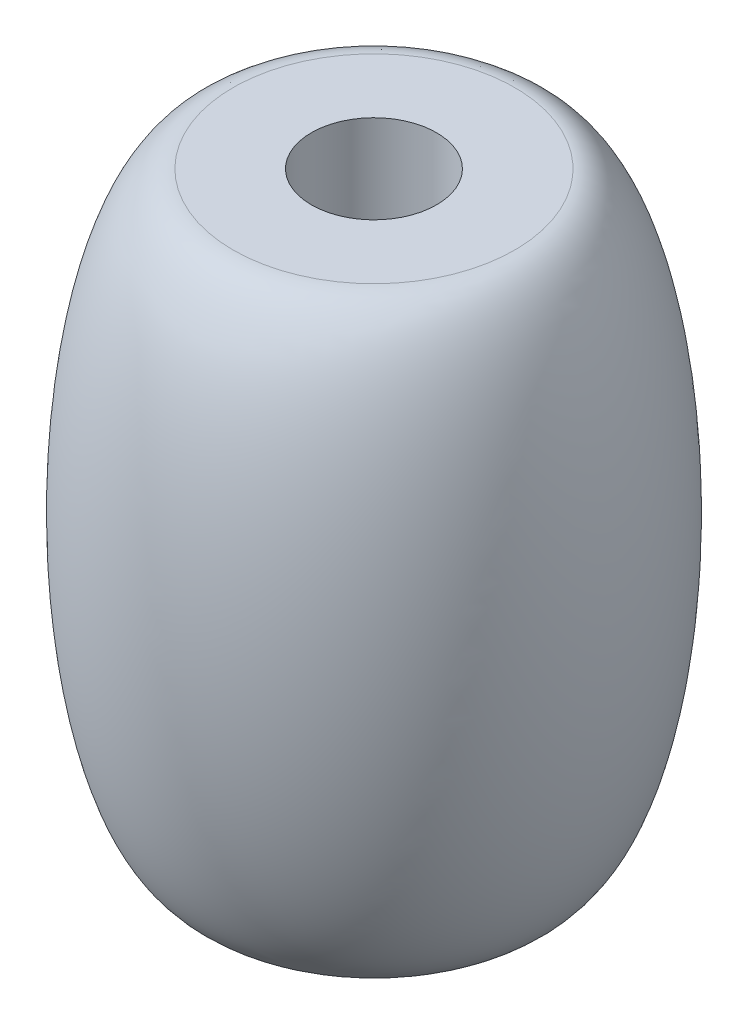
from build123d import *

# Parameters (mm, degrees)
SCALE_1_SCALE = 0.683


with BuildPart() as part:
    # 草图1 → 旋转2 (revolve)
    with BuildSketch(Plane.XY, mode=Mode.PRIVATE) as revolve_2_sk:
        with BuildLine():
            Line((-2, 9.5), (-2, -9.5))
            Line((-2, -9.5), (-4.499999838, -9.5))
            add(Edge.make_bspline(
                [(-4.499999838, 9.5), (-7.401567546, 9.500000347), (-7.401567546, 0), (-7.401567546, -9.500000347), (-4.499999838, -9.5)],
                knots=[3.141592617, 3.141592617, 3.141592617, 4.71238898, 4.71238898, 6.283185344, 6.283185344, 6.283185344], degree=2, weights=[1, 0.707106768, 1, 0.707106768, 1]))
            Line((-4.499999838, 9.5), (-2, 9.5))
        make_face()
    revolve(revolve_2_sk.sketch.rotate(Axis((0, 14.862602448, 0), (0, -1, 0)), 270), axis=Axis((0, 14.862602448, 0), (0, -1, 0)))


with BuildPart() as part_1:
    # 缩放比例1: scaled about (0, 0, -0.000363003)
    add(part.part.scale(SCALE_1_SCALE).moved(Location((0, 0, -0.000115072))))


solid = part_1.part
